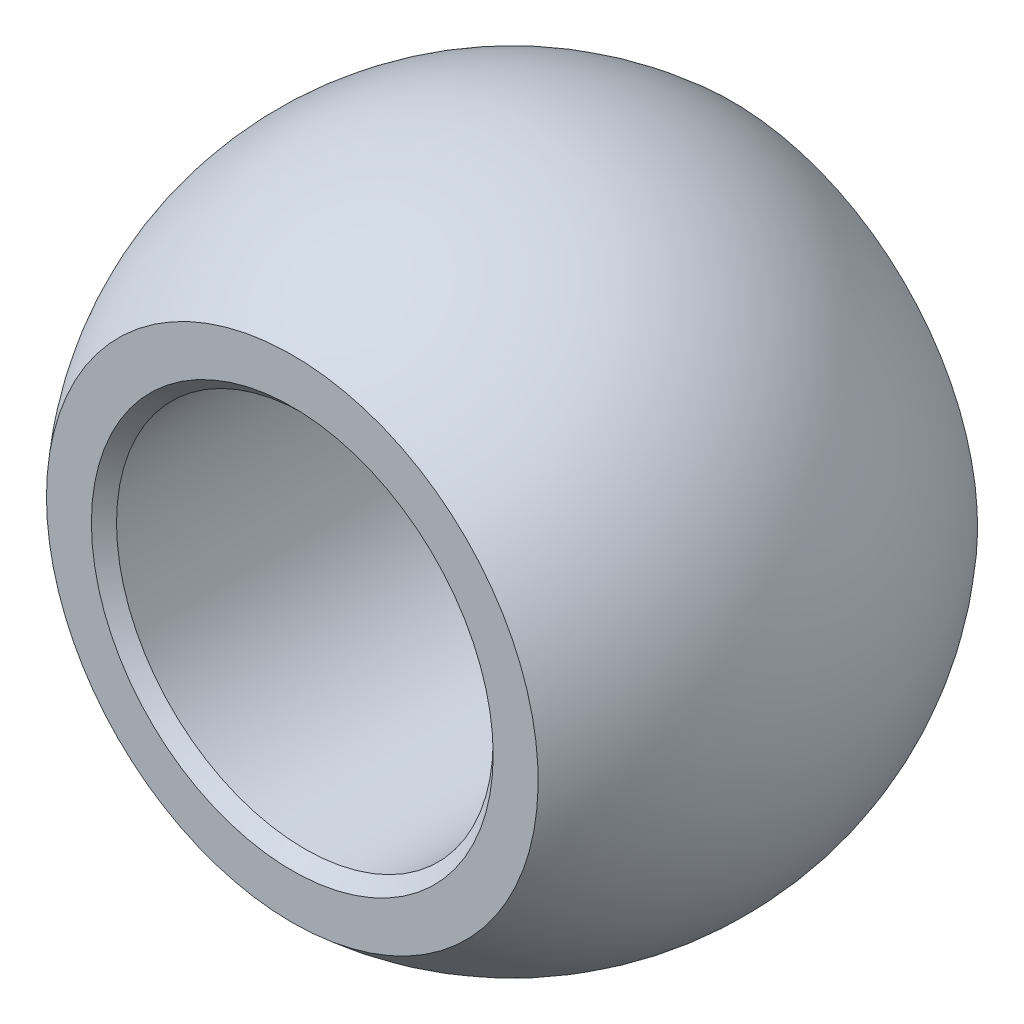
from build123d import *

# Parameters (mm, degrees)
CUT_EXTRUDE3_DEPTH      = 29.882120421
CUT_EXTRUDE3_DEPTH_BACK = 29.882120421
SKETCH8_W               = 11.1125
SKETCH8_H               = 101.6
CUT_EXTRUDE4_DEPTH      = 29.882120421
CUT_EXTRUDE4_DEPTH_BACK = 29.882120421
SKETCH10_R              = 9.525
CHAMFER1_SIZE           = 0.635


with BuildPart() as part:
    # Sketch7 → Revolve1 (revolve)
    with BuildSketch(Plane.XY):
        with BuildLine():
            Line((0, 16.6751), (0, -16.6751))
            ThreePointArc((0, -16.6751), (16.6751, 0), (0, 16.6751))
        make_face()
    revolve(axis=Axis((0, 22.114519505, 0), (0, -1, 0)))

    # Sketch8 → Cut-Extrude3 (cut, two sides: drawn at the far end of the back side and taken through both)
    with BuildSketch(Plane(origin=(0, 0, 0), x_dir=(0, 0, -1), z_dir=(1, 0, 0)).offset(-CUT_EXTRUDE3_DEPTH_BACK)):
        with Locations((-16.66875, 0)):
            Rectangle(SKETCH8_W, SKETCH8_H)
        with Locations((16.66875, 0)):
            Rectangle(SKETCH8_W, SKETCH8_H)
    extrude(amount=CUT_EXTRUDE3_DEPTH + CUT_EXTRUDE3_DEPTH_BACK, mode=Mode.SUBTRACT)

    # Sketch10 → Cut-Extrude4 (cut, two sides: drawn at the far end of the back side and taken through both)
    with BuildSketch(Plane.XY.offset(-CUT_EXTRUDE4_DEPTH_BACK)):
        Circle(SKETCH10_R)
    extrude(amount=CUT_EXTRUDE4_DEPTH + CUT_EXTRUDE4_DEPTH_BACK, mode=Mode.SUBTRACT)

    # Chamfer1
    chamfer1_edges = [part.edges().sort_by_distance(p)[0] for p in [
        (-9.525, 0, -11.1125),
        (-9.525, 0, 11.1125),
    ]]
    chamfer(chamfer1_edges, length=CHAMFER1_SIZE)


solid = part.part
